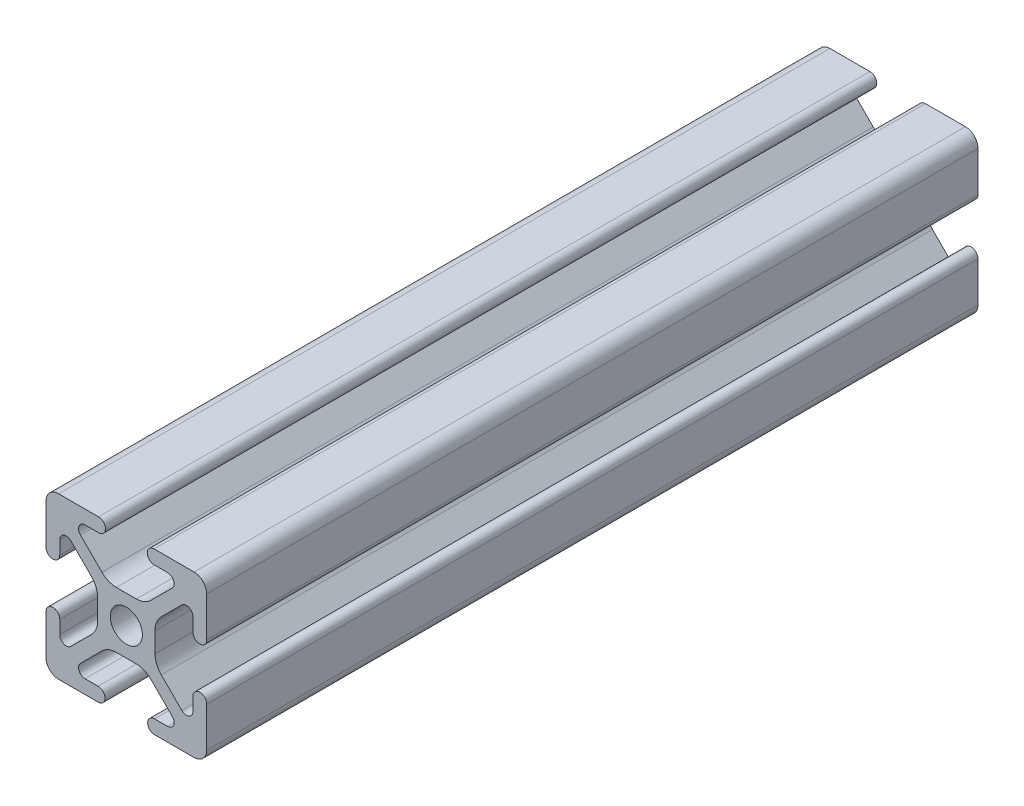
from build123d import *

# Parameters (mm, degrees)
SKETCH1_R           = 2.5
BOSS_EXTRUDE1_DEPTH = 120


with BuildPart() as part:
    # Sketch1 → Boss-Extrude1 (new body)
    with BuildSketch(Plane(origin=(0, 0, -25), x_dir=(-1, 0, 0), z_dir=(0, 0, -1))):
        with BuildLine():
            Line((12.5, 4.32), (12.5, 10.537068835))
            ThreePointArc((12.5, 10.537068835), (11.925070773, 11.925070773), (10.537068835, 12.5))
            Line((10.537068835, 12.5), (4.32, 12.5))
            ThreePointArc((4.32, 12.5), (3.25, 11.43), (4.32, 10.36))
            Line((4.32, 10.36), (6.42, 10.36))
            ThreePointArc((6.42, 10.36), (7.35325999, 9.736168088), (7.133653911, 8.635298598))
            Line((7.133653911, 8.635298598), (3.795290766, 5.301828272))
            ThreePointArc((3.795290766, 5.301828272), (2.76743922, 4.61585726), (1.555406707, 4.375))
            Line((1.555406707, 4.375), (-1.555406707, 4.375))
            ThreePointArc((-1.555406707, 4.375), (-2.76743922, 4.61585726), (-3.795290766, 5.301828272))
            Line((-3.795290766, 5.301828272), (-7.133653912, 8.635298598))
            ThreePointArc((-7.133653912, 8.635298598), (-7.35325999, 9.736168088), (-6.42, 10.36))
            Line((-6.42, 10.36), (-4.32, 10.36))
            ThreePointArc((-4.32, 10.36), (-3.25, 11.43), (-4.32, 12.5))
            Line((-4.32, 12.5), (-10.537068835, 12.5))
            ThreePointArc((-10.537068835, 12.5), (-11.925070773, 11.925070773), (-12.5, 10.537068835))
            Line((-12.5, 10.537068835), (-12.5, 4.32))
            ThreePointArc((-12.5, 4.32), (-11.43, 3.25), (-10.36, 4.32))
            Line((-10.36, 4.32), (-10.36, 6.396886949))
            ThreePointArc((-10.36, 6.396886949), (-9.736852394, 7.329863489), (-8.636346088, 7.111588351))
            Line((-8.636346088, 7.111588351), (-5.432204773, 3.912143135))
            ThreePointArc((-5.432204773, 3.912143135), (-4.708985779, 2.831057106), (-4.455, 1.555406707))
            Line((-4.455, 1.555406707), (-4.455, -1.555406707))
            ThreePointArc((-4.455, -1.555406707), (-4.708985779, -2.831057106), (-5.432204773, -3.912143135))
            Line((-5.432204773, -3.912143135), (-8.636346088, -7.111588351))
            ThreePointArc((-8.636346088, -7.111588351), (-9.736852394, -7.329863489), (-10.36, -6.396886949))
            Line((-10.36, -6.396886949), (-10.36, -4.32))
            ThreePointArc((-10.36, -4.32), (-11.43, -3.25), (-12.5, -4.32))
            Line((-12.5, -4.32), (-12.5, -10.537068835))
            ThreePointArc((-12.5, -10.537068835), (-11.925070773, -11.925070773), (-10.537068835, -12.5))
            Line((-10.537068835, -12.5), (-4.387856959, -12.5))
            ThreePointArc((-4.387856959, -12.5), (-3.317856959, -11.43), (-4.387856959, -10.36))
            Line((-4.387856959, -10.36), (-6.42, -10.36))
            ThreePointArc((-6.42, -10.36), (-7.35325999, -9.736168088), (-7.133653912, -8.635298598))
            Line((-7.133653912, -8.635298598), (-3.795290766, -5.301828272))
            ThreePointArc((-3.795290766, -5.301828272), (-2.76743922, -4.61585726), (-1.555406707, -4.375))
            Line((-1.555406707, -4.375), (1.555406707, -4.375))
            ThreePointArc((1.555406707, -4.375), (2.76743922, -4.61585726), (3.795290766, -5.301828272))
            Line((3.795290766, -5.301828272), (7.133653912, -8.635298598))
            ThreePointArc((7.133653912, -8.635298598), (7.35325999, -9.736168088), (6.42, -10.36))
            Line((6.42, -10.36), (4.387856959, -10.36))
            ThreePointArc((4.387856959, -10.36), (3.317856959, -11.43), (4.387856959, -12.5))
            Line((4.387856959, -12.5), (10.537068835, -12.5))
            ThreePointArc((10.537068835, -12.5), (11.925070773, -11.925070773), (12.5, -10.537068835))
            Line((12.5, -10.537068835), (12.5, -4.32))
            ThreePointArc((12.5, -4.32), (11.43, -3.25), (10.36, -4.32))
            Line((10.36, -4.32), (10.36, -6.396886949))
            ThreePointArc((10.36, -6.396886949), (9.736852394, -7.329863489), (8.636346088, -7.111588351))
            Line((8.636346088, -7.111588351), (5.432204773, -3.912143135))
            ThreePointArc((5.432204773, -3.912143135), (4.708985779, -2.831057106), (4.455, -1.555406707))
            Line((4.455, -1.555406707), (4.455, 1.555406707))
            ThreePointArc((4.455, 1.555406707), (4.708985779, 2.831057106), (5.432204773, 3.912143135))
            Line((5.432204773, 3.912143135), (8.636346088, 7.111588351))
            ThreePointArc((8.636346088, 7.111588351), (9.736852394, 7.329863489), (10.36, 6.396886949))
            Line((10.36, 6.396886949), (10.36, 4.32))
            ThreePointArc((10.36, 4.32), (11.43, 3.25), (12.5, 4.32))
        make_face()
        with Locations(Location((0, 0, 0), (0, 0, 180))):
            Circle(SKETCH1_R, mode=Mode.SUBTRACT)
    extrude(amount=-BOSS_EXTRUDE1_DEPTH)


solid = part.part
